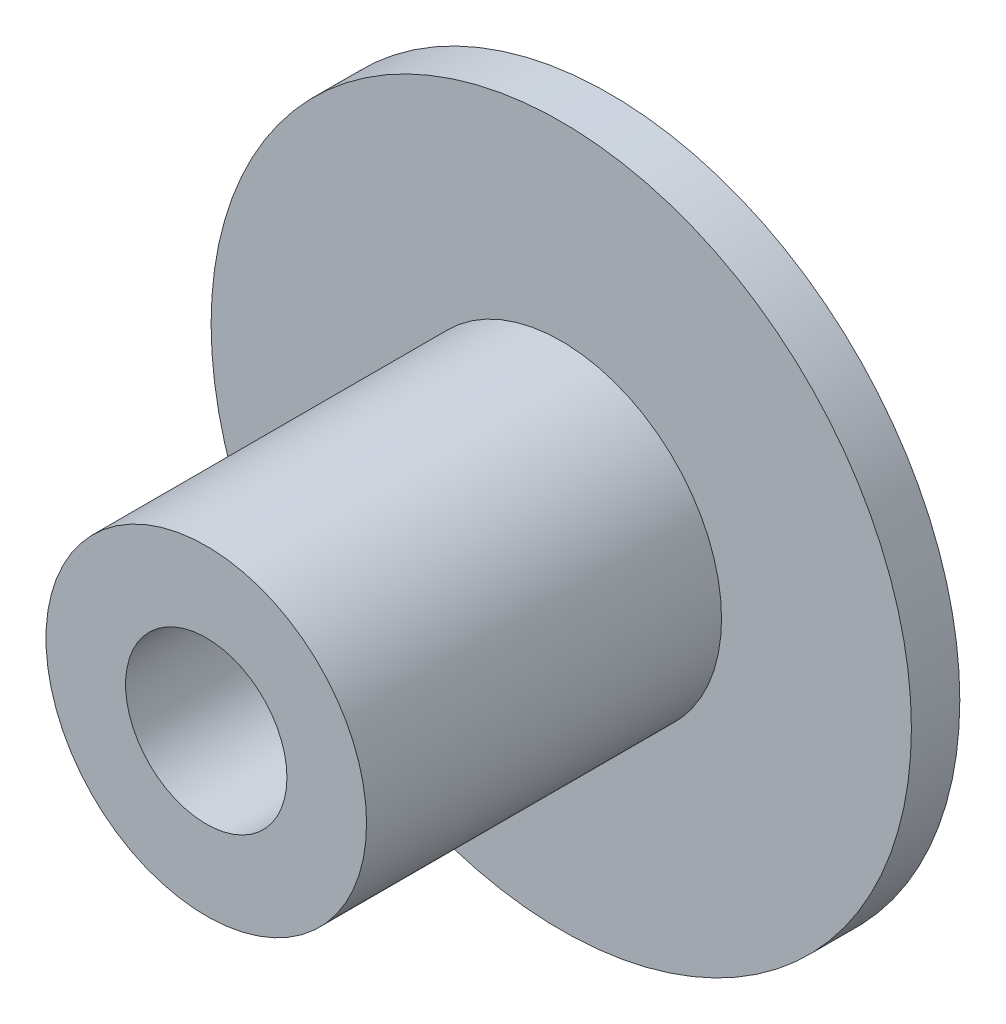
from build123d import *

# Parameters (mm, degrees)
SKIZZE1_R                       = 32.55
SKIZZE1_R_2                     = 7.5
AUFSATZ_LINEAR_AUSTRAGEN1_DEPTH = 4.5
SKIZZE2_R                       = 14.9
SKIZZE2_R_2                     = 7.5
AUFSATZ_LINEAR_AUSTRAGEN2_DEPTH = 33


with BuildPart() as part:
    # Skizze1 → Aufsatz-Linear austragen1 (new body)
    with BuildSketch(Plane.XY):
        Circle(SKIZZE1_R)
        Circle(SKIZZE1_R_2, mode=Mode.SUBTRACT)
    extrude(amount=AUFSATZ_LINEAR_AUSTRAGEN1_DEPTH)

    # Skizze2 → Aufsatz-Linear austragen2 (add)
    with BuildSketch(Plane.XY.offset(4.5)):
        Circle(SKIZZE2_R)
        Circle(SKIZZE2_R_2, mode=Mode.SUBTRACT)
    extrude(amount=AUFSATZ_LINEAR_AUSTRAGEN2_DEPTH)


solid = part.part
